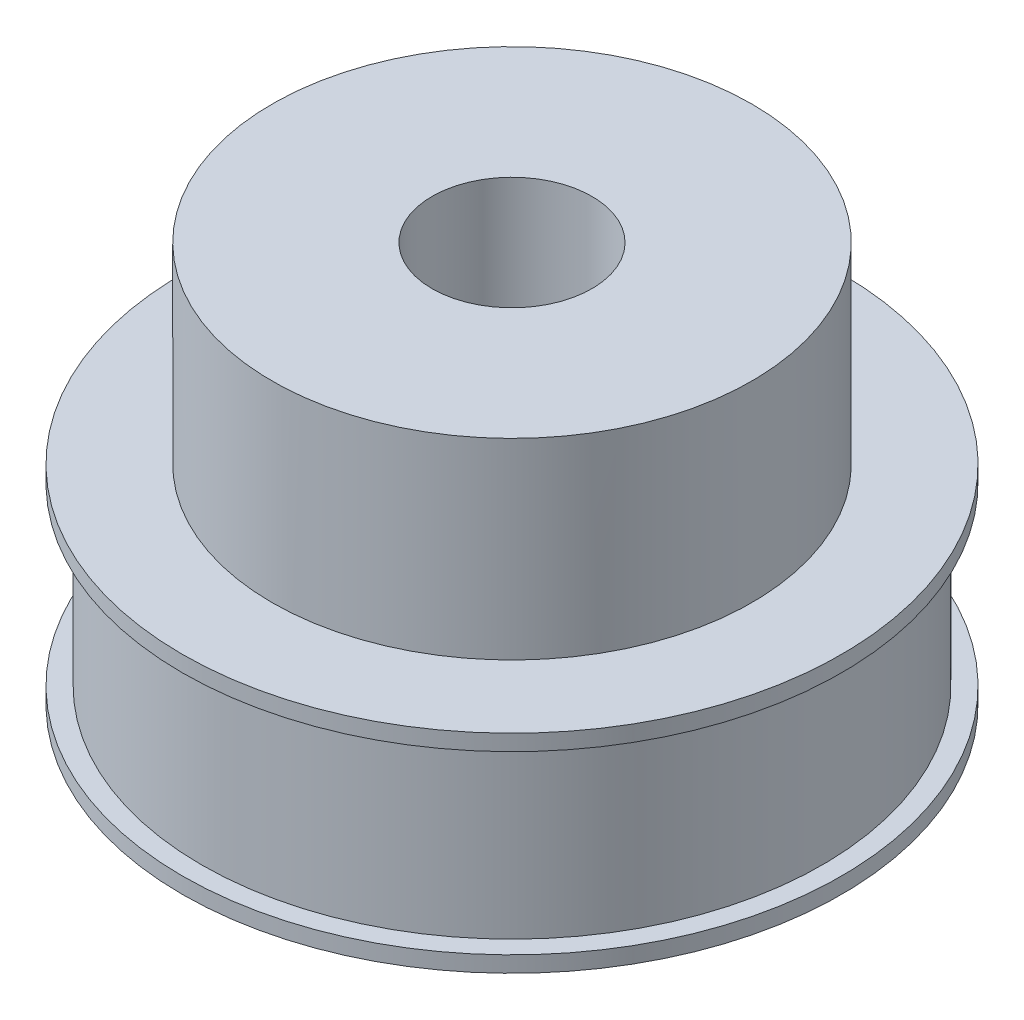
from build123d import *

# Parameters (mm, degrees)
SKETCH_1_R          = 19.405
EXTRUDE_1_DEPTH     = 11
SKETCH_2_R          = 20.605
EXTRUDE_2_DEPTH     = 1
SKETCH_3_R          = 15
EXTRUDE_3_DEPTH     = 12
SKETCH_4_R          = 5
CUT_EXTRUDE_1_DEPTH = 39.39442733


with BuildPart() as part:
    # 草图1 → 凸台-拉伸1 (new body)
    with BuildSketch(Plane(origin=(0, 0, 0), x_dir=(1, 0, 0), z_dir=(0, 1, 0))):
        with Locations(Location((0, 0, 0), (0, 0, 270))):
            Circle(SKETCH_1_R)
    extrude(amount=EXTRUDE_1_DEPTH)

    # 草图2 → 凸台-拉伸2 (add)
    with BuildSketch(Plane(origin=(0, 11, 0), x_dir=(1, 0, 0), z_dir=(0, 1, 0))):
        with Locations(Location((0, 0, 0), (0, 0, 270))):
            Circle(SKETCH_2_R)
    extrude_2 = extrude(amount=EXTRUDE_2_DEPTH)

    # 镜向1: 凸台-拉伸2 across plane
    add(extrude_2.mirror(Plane.ZX.offset(5.5)))

    # 草图3 → 凸台-拉伸3 (add)
    with BuildSketch(Plane(origin=(0, 12, 0), x_dir=(1, 0, 0), z_dir=(0, 1, 0))):
        with Locations(Location((0, 0, 0), (0, 0, 90))):
            Circle(SKETCH_3_R)
    extrude(amount=EXTRUDE_3_DEPTH)

    # 草图4 → 切除-拉伸1 (cut, through all)
    with BuildSketch(Plane(origin=(0, 24, 0), x_dir=(1, 0, 0), z_dir=(0, 1, 0))):
        with Locations(Location((0, 0, 0), (0, 0, 270))):
            Circle(SKETCH_4_R)
    extrude(amount=-CUT_EXTRUDE_1_DEPTH, mode=Mode.SUBTRACT)


solid = part.part
